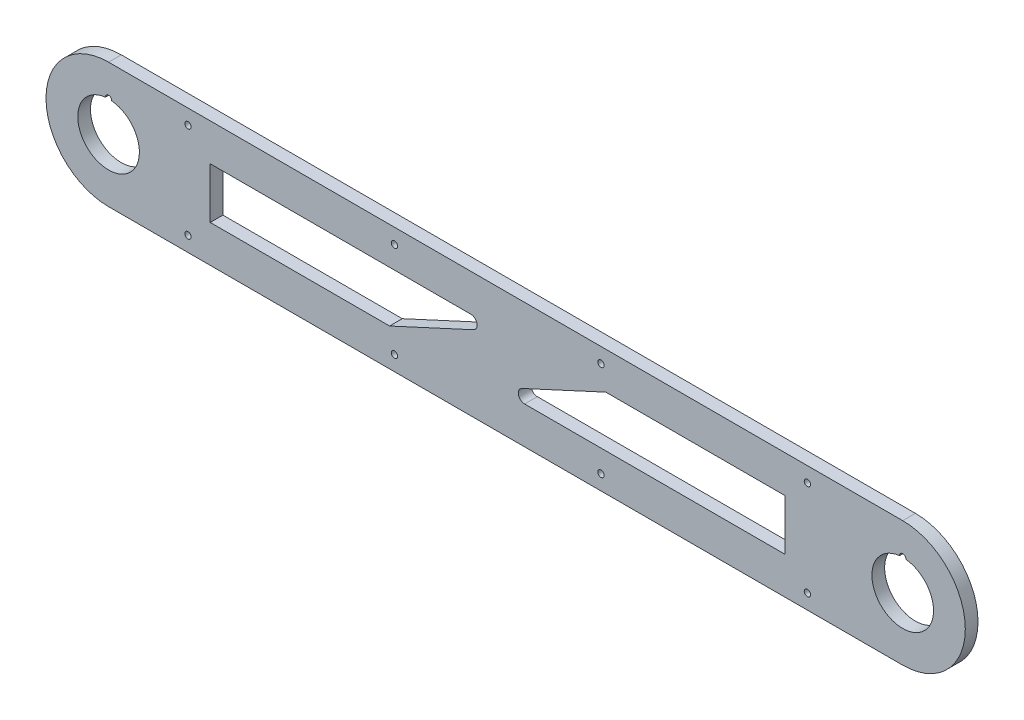
from build123d import *

# Parameters (mm, degrees)
SKETCH_1_R          = 9.7
EXTRUDE_1_DEPTH     = 4
SKETCH_2_R          = 1
CUT_EXTRUDE_1_DEPTH = 10
CUT_EXTRUDE_2_DEPTH = 10
SKETCH_4_R          = 1
CUT_EXTRUDE_3_DEPTH = 10


with BuildPart() as part:
    # 草图1 → 凸台-拉伸1 (new body)
    with BuildSketch(Plane.XY):
        with BuildLine():
            Line((0, 19.7), (250, 19.7))
            ThreePointArc((250, 19.7), (269.7, 0), (250, -19.7))
            Line((250, -19.7), (0, -19.7))
            ThreePointArc((0, -19.7), (-19.7, 0), (0, 19.7))
        make_face()
        Circle(SKETCH_1_R, mode=Mode.SUBTRACT)
        with Locations((250, 0)):
            Circle(SKETCH_1_R, mode=Mode.SUBTRACT)
    extrude(amount=EXTRUDE_1_DEPTH)

    # 草图2 → 切除-拉伸1 (cut)
    with BuildSketch(Plane.XY.offset(4)):
        with Locations((25, 15)):
            Circle(SKETCH_2_R)
        with Locations((90, 15)):
            Circle(SKETCH_2_R)
        with Locations((155, 15)):
            Circle(SKETCH_2_R)
        with Locations((220, 15)):
            Circle(SKETCH_2_R)
        with Locations((90, -15)):
            Circle(SKETCH_2_R)
        with Locations((155, -15)):
            Circle(SKETCH_2_R)
        with Locations((220, -15)):
            Circle(SKETCH_2_R)
        with Locations((25, -15)):
            Circle(SKETCH_2_R)
    extrude(amount=-CUT_EXTRUDE_1_DEPTH, mode=Mode.SUBTRACT)

    # 草图3 → 切除-拉伸2 (cut)
    with BuildSketch(Plane.XY.offset(4)):
        with BuildLine():
            Line((32, 8), (114.023268405, 8))
            ThreePointArc((114.023268405, 8), (115.976706085, 6.429046887), (114.86138476, 4.184081231))
            Line((114.86138476, 4.184081231), (88.462542093, -8))
            Line((88.462542093, -8), (32, -8))
            Line((32, -8), (32, 8))
        make_face()
        with BuildLine():
            Line((156.537457907, 8), (130.13861524, -4.184081231))
            ThreePointArc((130.13861524, -4.184081231), (129.023293915, -6.429046887), (130.976731595, -8))
            Line((130.976731595, -8), (213, -8))
            Line((213, -8), (213, 8))
            Line((213, 8), (156.537457907, 8))
        make_face()
    extrude(amount=-CUT_EXTRUDE_2_DEPTH, mode=Mode.SUBTRACT)

    # 草图4 → 切除-拉伸3 (cut)
    with BuildSketch(Plane.XY.offset(4)):
        with Locations((0, 9.7)):
            Circle(SKETCH_4_R)
        with Locations((250, 9.7)):
            Circle(SKETCH_4_R)
    extrude(amount=-CUT_EXTRUDE_3_DEPTH, mode=Mode.SUBTRACT)


solid = part.part
